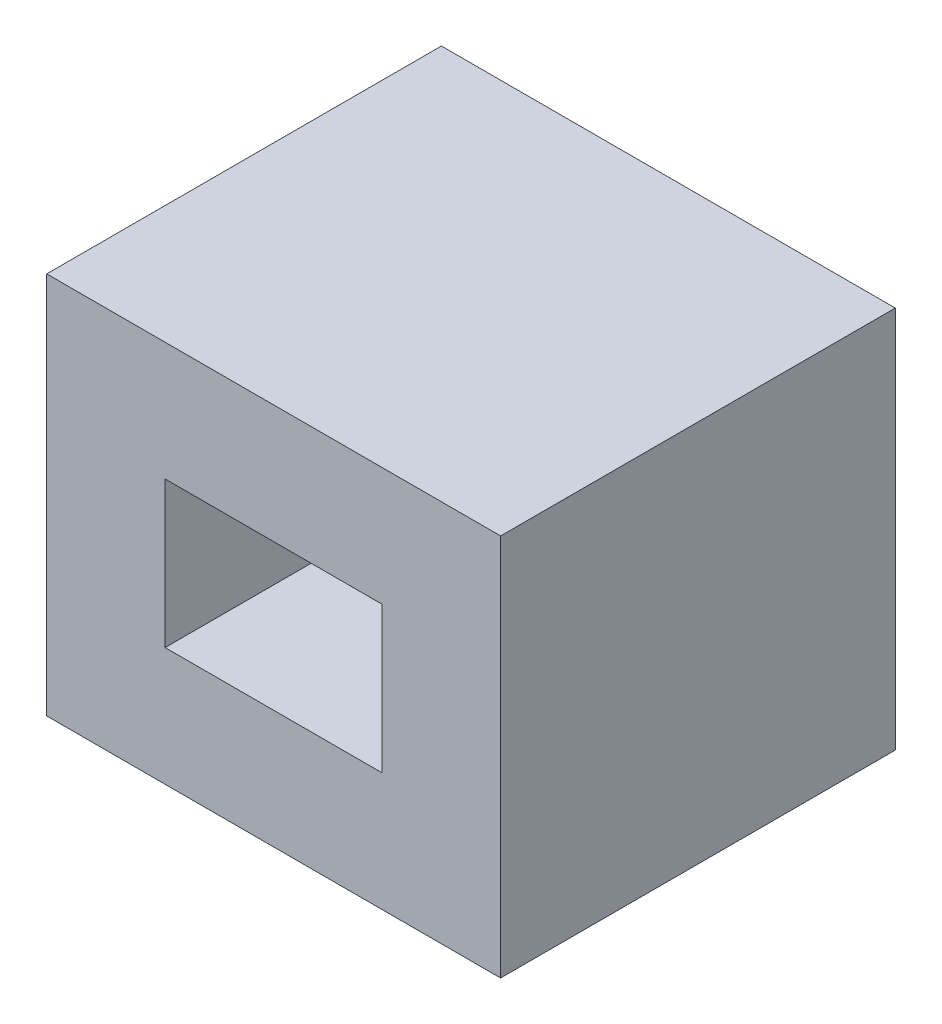
from build123d import *

# Parameters (mm, degrees)
SKETCH1_W           = 11.5
SKETCH1_H           = 9.7
SKETCH1_W_2         = 5.5
SKETCH1_H_2         = 3.7
BOSS_EXTRUDE1_DEPTH = 10


with BuildPart() as part:
    # Sketch1 → Boss-Extrude1 (new body)
    with BuildSketch(Plane.XY):
        Rectangle(SKETCH1_W, SKETCH1_H)
        Rectangle(SKETCH1_W_2, SKETCH1_H_2, mode=Mode.SUBTRACT)
    extrude(amount=BOSS_EXTRUDE1_DEPTH)


solid = part.part
